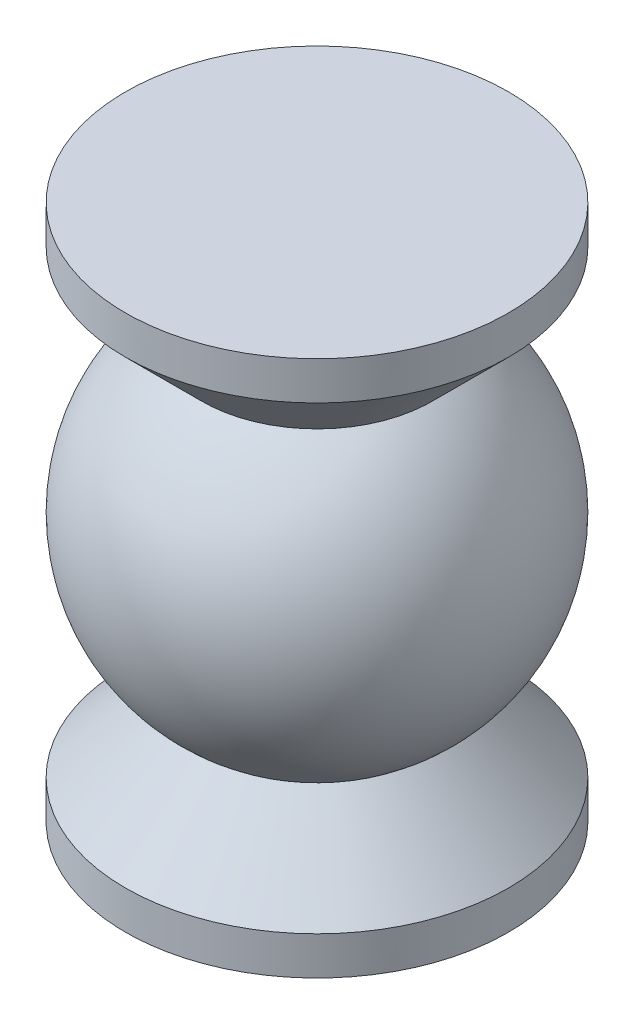
from build123d import *

# Parameters (mm, degrees)
SKETCH_1_W = 25
SKETCH_1_H = 5


with BuildPart() as part:
    # 草图1 → 旋转1 (revolve)
    with BuildSketch(Plane.XY):
        with BuildLine():
            Line((-15, -20), (0, -20))
            Line((0, -20), (0, 20))
            Line((0, 20), (-15, 20))
            ThreePointArc((-15, 20), (-25, 0), (-15, -20))
        make_face()
        Polygon((-15, 20), (0, 20), (0, 30), (-25, 30), align=None)
        with Locations((-12.5, 32.5)):
            Rectangle(SKETCH_1_W, SKETCH_1_H)
    revolve_1 = revolve(axis=Axis((0, -20, 0), (0, 1, 0)))

    # 镜向1: 旋转1 across plane
    add(revolve_1.mirror(Plane.ZX))


solid = part.part
